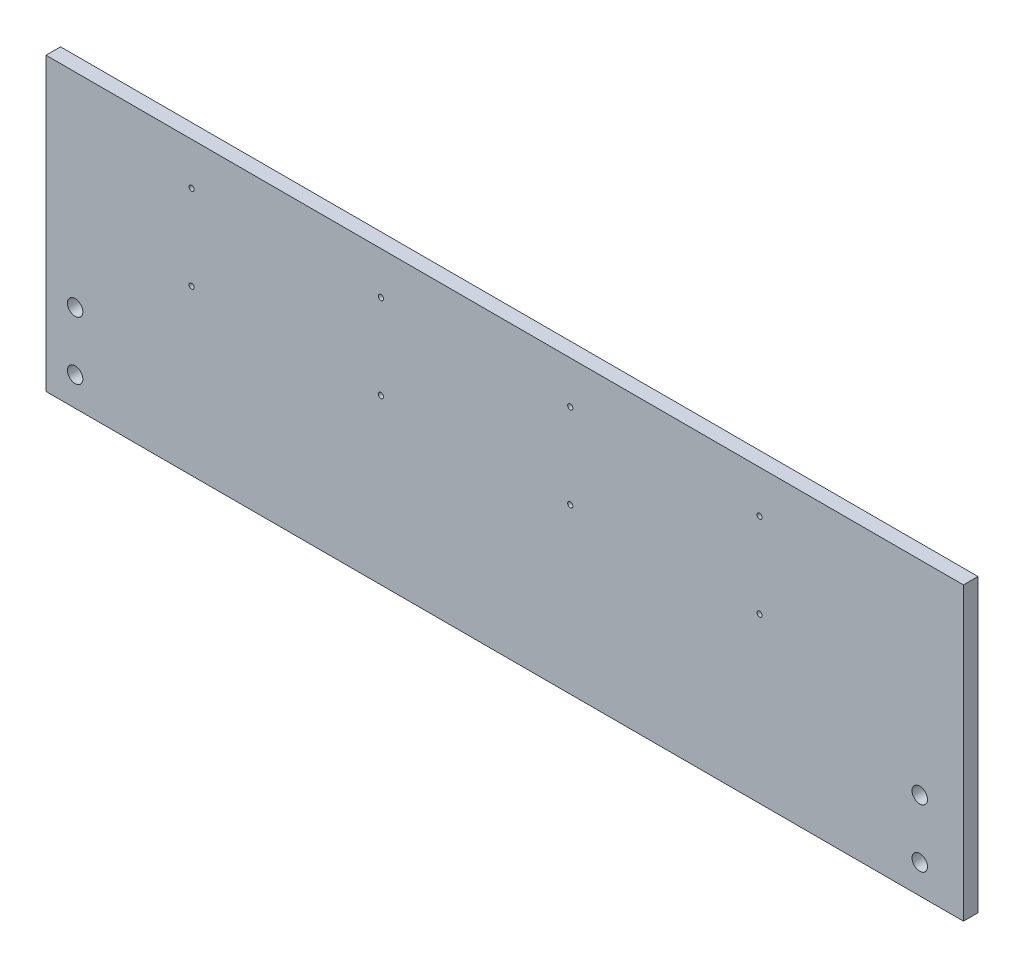
from build123d import *

# Parameters (mm, degrees)
SKETCH1_W             = 400.05
SKETCH1_H             = 127
BOSS_EXTRUDE1_DEPTH   = 6.35
SKETCH2_R             = 3.3655
CUT_EXTRUDE1_DEPTH    = 210.958503341
F_4_40_TAPPED_HOLE1_D = 2.2606


with BuildPart() as part:
    # Sketch1 → Boss-Extrude1 (new body)
    with BuildSketch(Plane.XY):
        Rectangle(SKETCH1_W, SKETCH1_H)
    extrude(amount=BOSS_EXTRUDE1_DEPTH)

    # Sketch2 → Cut-Extrude1 (cut, through all)
    with BuildSketch(Plane(origin=(0, 0, 0), x_dir=(-1, 0, 0), z_dir=(0, 0, -1))):
        with Locations((-180.975, -50.8)):
            Circle(SKETCH2_R)
        with Locations((-180.975, -25.4)):
            Circle(SKETCH2_R)
        with Locations((187.325, -50.8)):
            Circle(SKETCH2_R)
        with Locations((187.325, -25.4)):
            Circle(SKETCH2_R)
    extrude(amount=-CUT_EXTRUDE1_DEPTH, mode=Mode.SUBTRACT)

    # #4-40 Tapped Hole1 (through all)
    with Locations(Plane.XY.offset(6.35)):
        with Locations((-136.525, 45.025), (-136.525, 8.025), (-53.975, 45.025), (-53.975, 8.025), (28.575, 45.025), (28.575, 8.025), (111.125, 45.025), (111.125, 8.025)):
            Hole(F_4_40_TAPPED_HOLE1_D / 2)


solid = part.part
